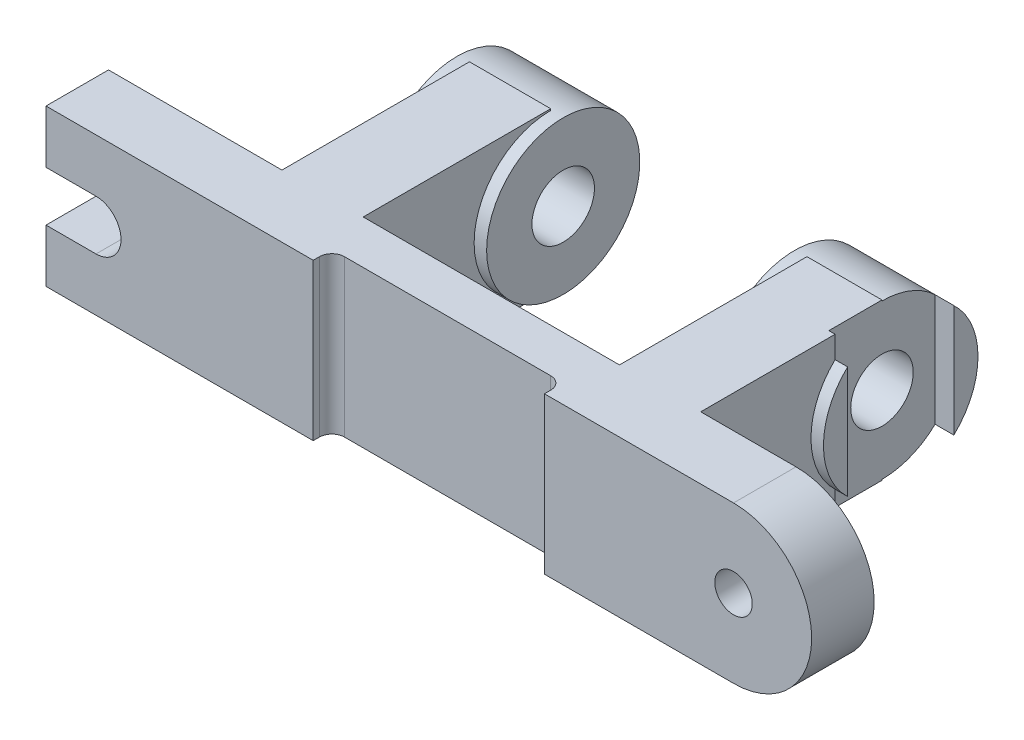
from build123d import *

# Parameters (mm, degrees)
BOSS_EXTRUDE1_DEPTH              = 20
CUT_EXTRUDE1_DEPTH               = 80
M14X2_0_TAPPED_HOLE2_D           = 12
M14X2_0_TAPPED_HOLE2_CSINK_D     = 14.05
M14X2_0_TAPPED_HOLE2_CSINK_ANGLE = 90
SKETCH11_W                       = 26
SKETCH11_H                       = 50
BOSS_EXTRUDE2_DEPTH              = 60
BOSS_EXTRUDE3_START              = 4
SKETCH12_R                       = 24.50968872
BOSS_EXTRUDE3_DEPTH              = 34
BOSS_EXTRUDE4_START              = 4
SKETCH13_R                       = 24.725624797
BOSS_EXTRUDE4_DEPTH              = 34
SKETCH14_R                       = 10
CUT_EXTRUDE2_DEPTH               = 234
SKETCH15_W                       = 34
SKETCH15_H                       = 100.230824912
CUT_EXTRUDE3_DEPTH               = 6
RIB6_REACH                       = 189.964
SKETCH16_WALL_W                  = 418.569099694
SKETCH16_WALL_H                  = 16


with BuildPart() as part:
    # Sketch1 → Boss-Extrude1 (new body)
    with BuildSketch(Plane.XY):
        with BuildLine():
            Line((-165.913043478, -4.304347826), (54.086956522, -4.304347826))
            ThreePointArc((54.086956522, -4.304347826), (79.086956522, 20.695652174), (54.086956522, 45.695652174))
            Line((54.086956522, 45.695652174), (-165.913043478, 45.695652174))
            Line((-165.913043478, 45.695652174), (-165.913043478, 28.695652174))
            Line((-165.913043478, 28.695652174), (-149.913043478, 28.695652174))
            ThreePointArc((-149.913043478, 28.695652174), (-141.913043478, 20.695652174), (-149.913043478, 12.695652174))
            Line((-149.913043478, 12.695652174), (-165.913043478, 12.695652174))
            Line((-165.913043478, 12.695652174), (-165.913043478, -4.304347826))
        make_face()
    extrude(amount=BOSS_EXTRUDE1_DEPTH)

    # Sketch2 → Cut-Extrude1 (cut)
    with BuildSketch(Plane(origin=(0, 45.695652174, 0), x_dir=(1, 0, 0), z_dir=(0, 1, 0))):
        with BuildLine():
            Line((-80.413043478, -20), (-6.413043478, -20))
            Line((-6.413043478, -20), (-6.413043478, -18))
            ThreePointArc((-6.413043478, -18), (-7.584616354, -15.171572875), (-10.413043478, -14))
            Line((-10.413043478, -14), (-76.413043478, -14))
            ThreePointArc((-76.413043478, -14), (-79.241470603, -15.171572875), (-80.413043478, -18))
            Line((-80.413043478, -18), (-80.413043478, -20))
        make_face()
    extrude(amount=-CUT_EXTRUDE1_DEPTH, mode=Mode.SUBTRACT)

    # M14x2.0 Tapped Hole2 (through all)
    with Locations(Plane(origin=(0, 0, 0), x_dir=(-1, 0, 0), z_dir=(0, 0, -1))):
        with Locations((-54.086956522, 20.695652174)):
            CounterSinkHole(M14X2_0_TAPPED_HOLE2_D / 2, M14X2_0_TAPPED_HOLE2_CSINK_D / 2, counter_sink_angle=M14X2_0_TAPPED_HOLE2_CSINK_ANGLE)

    # Sketch11 → Boss-Extrude2 (add)
    with BuildSketch(Plane(origin=(0, 0, 0), x_dir=(-1, 0, 0), z_dir=(0, 0, -1))):
        with Locations((97.413043478, 20.695652174)):
            Rectangle(SKETCH11_W, SKETCH11_H)
        with Locations((-10.586956522, 20.695652174)):
            Rectangle(SKETCH11_W, SKETCH11_H)
    extrude(amount=BOSS_EXTRUDE2_DEPTH)

    # Sketch12 → Boss-Extrude3 (add)
    with BuildSketch(Plane.ZY.offset(110.413043478).offset(BOSS_EXTRUDE3_START)):
        with Locations((-60, 20.695652174)):
            Circle(SKETCH12_R)
    extrude(amount=-BOSS_EXTRUDE3_DEPTH)

    # Sketch13 → Boss-Extrude4 (add)
    with BuildSketch(Plane.ZY.offset(2.413043478).offset(BOSS_EXTRUDE4_START)):
        with Locations(Location((-60, 20.695652174, 0), (0, 0, 270))):
            Circle(SKETCH13_R)
    extrude(amount=-BOSS_EXTRUDE4_DEPTH)

    # Sketch14 → Cut-Extrude2 (cut)
    with BuildSketch(Plane(origin=(27.586956522, 0, 0), x_dir=(0, 0, -1), z_dir=(1, 0, 0))):
        with Locations(Location((60, 20.695652174, 0), (0, 0, 90))):
            Circle(SKETCH14_R)
    extrude(amount=-CUT_EXTRUDE2_DEPTH, mode=Mode.SUBTRACT)

    # Sketch15 → Cut-Extrude3 (cut)
    with BuildSketch(Plane(origin=(27.586956522, 0, 0), x_dir=(0, 0, -1), z_dir=(1, 0, 0))):
        with Locations((60, 20.695652174)):
            Rectangle(SKETCH15_W, SKETCH15_H)
    extrude(amount=-CUT_EXTRUDE3_DEPTH, mode=Mode.SUBTRACT)

    # Sketch16 wall → Rib6 (add, up to next)
    with BuildSketch(Plane(origin=(-122.592806802, 20.695652174, -18.5875655), x_dir=(-0.404065346257, 0, 0.914730121924), z_dir=(0.914730121924, 0, 0.404065346257)), mode=Mode.PRIVATE) as rib6_sk1:
        Rectangle(SKETCH16_WALL_W, SKETCH16_WALL_H)
    rib6_tool1 = extrude(rib6_sk1.sketch, amount=RIB6_REACH, mode=Mode.PRIVATE) - part.part
    add(rib6_tool1.solids().sort_by_distance((-122.592806802, 20.695652174, -18.5875655))[0])


solid = part.part
